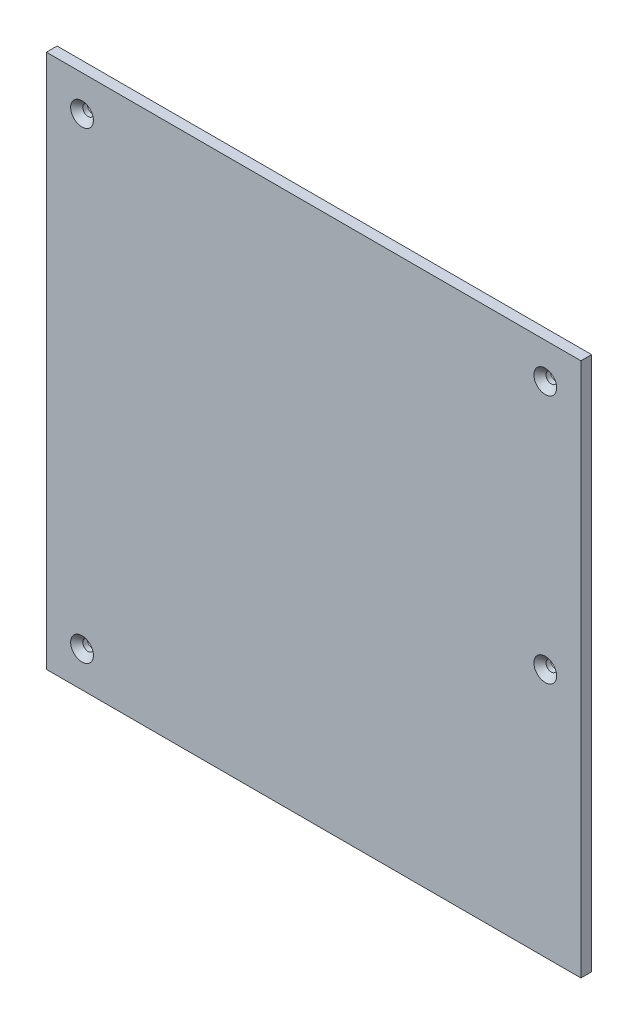
from build123d import *

# Parameters (mm, degrees)
ESBO_O1_W                = 150
ESBO_O1_H                = 150
RESSALTO_EXTRUS_O1_DEPTH = 3
ESBO_O2_R                = 1.5
CORTE_EXTRUS_O1_DEPTH    = 3
CHANFRO1_SIZE            = 1.7


with BuildPart() as part:
    # Esboço1 → Ressalto-extrusão1 (new body)
    with BuildSketch(Plane.XY):
        Rectangle(ESBO_O1_W, ESBO_O1_H)
    extrude(amount=RESSALTO_EXTRUS_O1_DEPTH)

    # Esboço2 → Corte-extrusão1 (cut)
    with BuildSketch(Plane(origin=(0, 0, 0), x_dir=(-1, 0, 0), z_dir=(0, 0, -1))):
        with Locations((65, -65)):
            Circle(ESBO_O2_R)
        with Locations((65, 65)):
            Circle(ESBO_O2_R)
        with Locations((-65, 65)):
            Circle(ESBO_O2_R)
        with Locations((-65, -5)):
            Circle(ESBO_O2_R)
    extrude(amount=-CORTE_EXTRUS_O1_DEPTH, mode=Mode.SUBTRACT)

    # Chanfro1
    chanfro1_edges = [part.edges().sort_by_distance(p)[0] for p in [
        (-63.5, -65, 3),
        (-63.5, 65, 3),
        (66.5, 65, 3),
        (66.5, -5, 3),
    ]]
    chamfer(chanfro1_edges, length=CHANFRO1_SIZE)


solid = part.part
